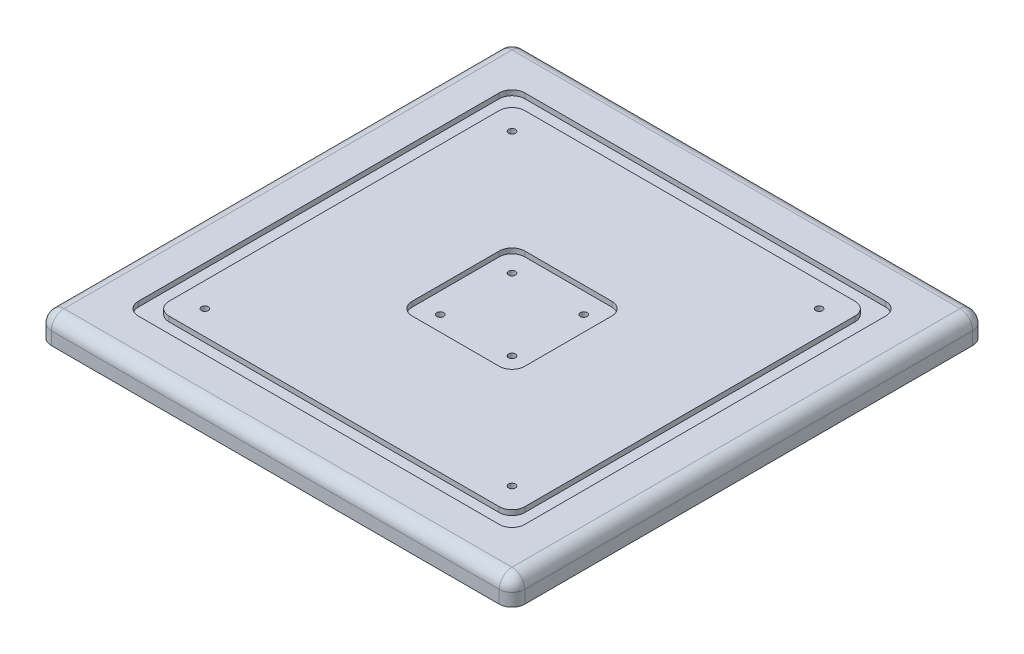
from build123d import *

# Parameters (mm, degrees)
BOSS_EXTRUDE1_DEPTH                                  = 12.7
FILLET1_R                                            = 6.35
CUT_EXTRUDE1_DEPTH                                   = 2.54
BOSS_EXTRUDE2_DEPTH                                  = 2.54
CSK_FOR_M3_HEX_SOCKET_COUNTERSUNK_CAP_SC_D           = 3.4
CSK_FOR_M3_HEX_SOCKET_COUNTERSUNK_CAP_SC_CSINK_D     = 6.72
CSK_FOR_M3_HEX_SOCKET_COUNTERSUNK_CAP_SC_CSINK_ANGLE = 90
CUT_EXTRUDE2_DEPTH                                   = 2.54
CSK_FOR_M3_HEX_SOCKET_COUNTERSUNK_CA_2_D             = 3.4
CSK_FOR_M3_HEX_SOCKET_COUNTERSUNK_CA_2_CSINK_D       = 6.72
CSK_FOR_M3_HEX_SOCKET_COUNTERSUNK_CA_2_CSINK_ANGLE   = 90


with BuildPart() as part:
    # Sketch2 → Boss-Extrude1 (new body)
    with BuildSketch(Plane(origin=(0, 759.298436, 0), x_dir=(-1, 0, 0), z_dir=(0, -1, 0))):
        with BuildLine():
            Line((-449.975603201, -1350.757525912), (-672.225603201, -1350.757525912))
            ThreePointArc((-672.225603201, -1350.757525912), (-676.715731261, -1348.897653973), (-678.575603201, -1344.407525912))
            Line((-678.575603201, -1344.407525912), (-678.575603201, -1122.157525912))
            ThreePointArc((-678.575603201, -1122.157525912), (-676.715731261, -1117.667397852), (-672.225603201, -1115.807525912))
            Line((-672.225603201, -1115.807525912), (-449.975603201, -1115.807525912))
            ThreePointArc((-449.975603201, -1115.807525912), (-445.48547514, -1117.667397852), (-443.625603201, -1122.157525912))
            Line((-443.625603201, -1122.157525912), (-443.625603201, -1344.407525912))
            ThreePointArc((-443.625603201, -1344.407525912), (-445.48547514, -1348.897653973), (-449.975603201, -1350.757525912))
        make_face()
    extrude(amount=BOSS_EXTRUDE1_DEPTH)

    # Fillet1
    fillet1_edges = [part.edges().sort_by_distance(p)[0] for p in [
        (678.575603201, 759.298436, 1233.282525912),
        (676.715731261, 759.298436, 1117.667397852),
        (561.100603201, 759.298436, 1115.807525912),
        (445.48547514, 759.298436, 1117.667397852),
        (443.625603201, 759.298436, 1233.282525912),
        (445.48547514, 759.298436, 1348.897653973),
        (561.100603201, 759.298436, 1350.757525912),
        (676.715731261, 759.298436, 1348.897653973),
    ]]
    fillet(fillet1_edges, radius=FILLET1_R)

    # Sketch4 → Cut-Extrude1 (cut)
    with BuildSketch(Plane(origin=(0, 759.298436, 0), x_dir=(1, 0, 0), z_dir=(0, 1, 0))):
        with BuildLine():
            Line((471.565603201, -1329.167525912), (650.635603201, -1329.167525912))
            ThreePointArc((650.635603201, -1329.167525912), (655.125731261, -1327.307653973), (656.985603201, -1322.817525912))
            Line((656.985603201, -1322.817525912), (656.985603201, -1143.747525912))
            ThreePointArc((656.985603201, -1143.747525912), (655.125731261, -1139.257397852), (650.635603201, -1137.397525912))
            Line((650.635603201, -1137.397525912), (471.565603201, -1137.397525912))
            ThreePointArc((471.565603201, -1137.397525912), (467.07547514, -1139.257397852), (465.215603201, -1143.747525912))
            Line((465.215603201, -1143.747525912), (465.215603201, -1322.817525912))
            ThreePointArc((465.215603201, -1322.817525912), (467.07547514, -1327.307653973), (471.565603201, -1329.167525912))
        make_face()
    extrude(amount=-CUT_EXTRUDE1_DEPTH, mode=Mode.SUBTRACT)

    # Sketch5 → Boss-Extrude2 (add)
    with BuildSketch(Plane(origin=(0, 756.758436, 0), x_dir=(1, 0, 0), z_dir=(0, 1, 0))):
        with BuildLine():
            Line((479.185603201, -1321.547525912), (643.015603201, -1321.547525912))
            ThreePointArc((643.015603201, -1321.547525912), (647.505731261, -1319.687653973), (649.365603201, -1315.197525912))
            Line((649.365603201, -1315.197525912), (649.365603201, -1151.367525912))
            ThreePointArc((649.365603201, -1151.367525912), (647.505731261, -1146.877397852), (643.015603201, -1145.017525912))
            Line((643.015603201, -1145.017525912), (479.185603201, -1145.017525912))
            ThreePointArc((479.185603201, -1145.017525912), (474.69547514, -1146.877397852), (472.835603201, -1151.367525912))
            Line((472.835603201, -1151.367525912), (472.835603201, -1315.197525912))
            ThreePointArc((472.835603201, -1315.197525912), (474.69547514, -1319.687653973), (479.185603201, -1321.547525912))
        make_face()
    extrude(amount=BOSS_EXTRUDE2_DEPTH)

    # CSK for M3 Hex Socket Countersunk Cap Sc (through all)
    with Locations(Plane.XZ.offset(-746.598436)):
        with Locations((484.900603201, 1157.082525912), (484.900603201, 1309.482525912), (637.300603201, 1309.482525912), (637.300603201, 1157.082525912)):
            CounterSinkHole(CSK_FOR_M3_HEX_SOCKET_COUNTERSUNK_CAP_SC_D / 2, CSK_FOR_M3_HEX_SOCKET_COUNTERSUNK_CAP_SC_CSINK_D / 2, counter_sink_angle=CSK_FOR_M3_HEX_SOCKET_COUNTERSUNK_CAP_SC_CSINK_ANGLE)

    # Sketch11 → Cut-Extrude2 (cut)
    with BuildSketch(Plane(origin=(0, 759.298436, 0), x_dir=(1, 0, 0), z_dir=(0, 1, 0))):
        with BuildLine():
            Line((539.510603201, -1261.222525912), (582.690603201, -1261.222525912))
            ThreePointArc((582.690603201, -1261.222525912), (587.180731261, -1259.362653973), (589.040603201, -1254.872525912))
            Line((589.040603201, -1254.872525912), (589.040603201, -1211.692525912))
            ThreePointArc((589.040603201, -1211.692525912), (587.180731261, -1207.202397852), (582.690603201, -1205.342525912))
            Line((582.690603201, -1205.342525912), (539.510603201, -1205.342525912))
            ThreePointArc((539.510603201, -1205.342525912), (535.02047514, -1207.202397852), (533.160603201, -1211.692525912))
            Line((533.160603201, -1211.692525912), (533.160603201, -1254.872525912))
            ThreePointArc((533.160603201, -1254.872525912), (535.02047514, -1259.362653973), (539.510603201, -1261.222525912))
        make_face()
    extrude(amount=-CUT_EXTRUDE2_DEPTH, mode=Mode.SUBTRACT)

    # CSK for M3 Hex Socket Countersunk Ca 2 (through all)
    with Locations(Plane.XZ.offset(-746.598436)):
        with Locations((578.880603201, 1215.502525912), (543.320603201, 1215.502525912), (543.320603201, 1251.062525912), (578.880603201, 1251.062525912)):
            CounterSinkHole(CSK_FOR_M3_HEX_SOCKET_COUNTERSUNK_CA_2_D / 2, CSK_FOR_M3_HEX_SOCKET_COUNTERSUNK_CA_2_CSINK_D / 2, counter_sink_angle=CSK_FOR_M3_HEX_SOCKET_COUNTERSUNK_CA_2_CSINK_ANGLE)


solid = part.part
